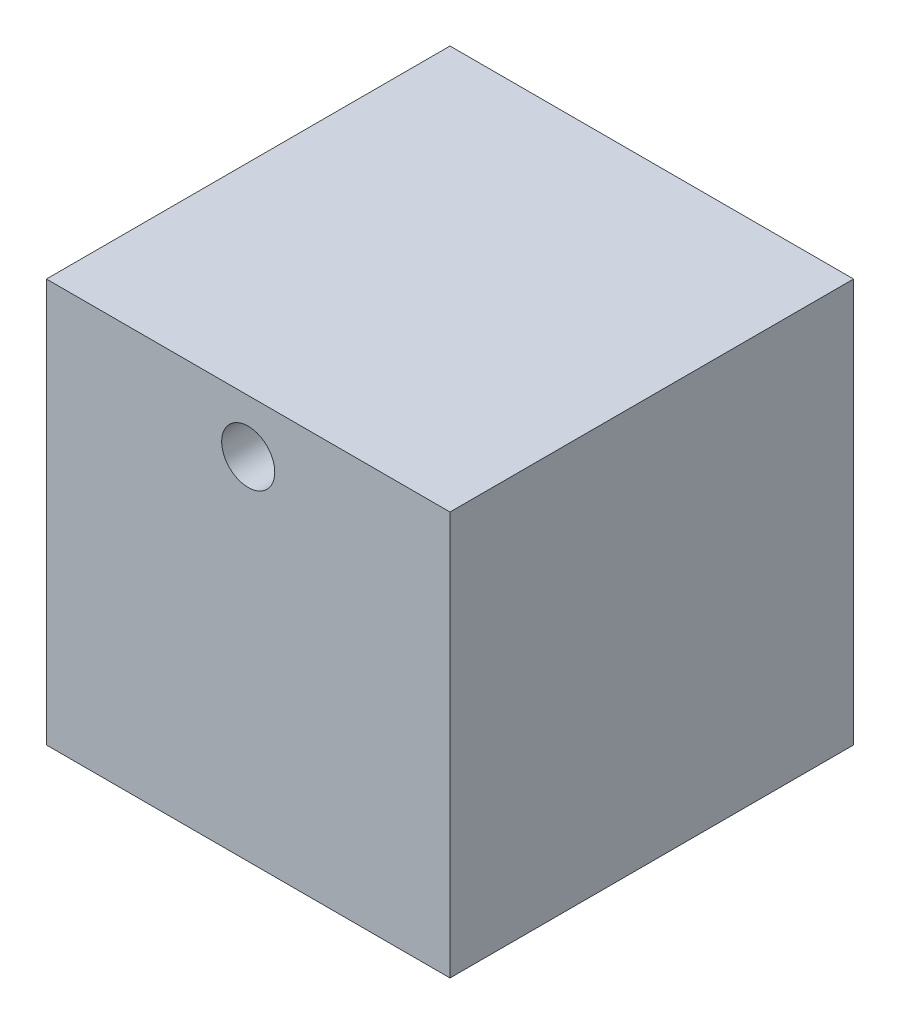
from build123d import *

# Parameters (mm, degrees)
SKETCH1_W           = 38
SKETCH1_H           = 38
SKETCH1_R           = 2.5
BOSS_EXTRUDE1_DEPTH = 38


with BuildPart() as part:
    # Sketch1 → Boss-Extrude1 (new body)
    with BuildSketch(Plane.XY):
        with Locations((19, 19)):
            Rectangle(SKETCH1_W, SKETCH1_H)
        with Locations((19, 33)):
            Circle(SKETCH1_R, mode=Mode.SUBTRACT)
    extrude(amount=BOSS_EXTRUDE1_DEPTH)


solid = part.part
